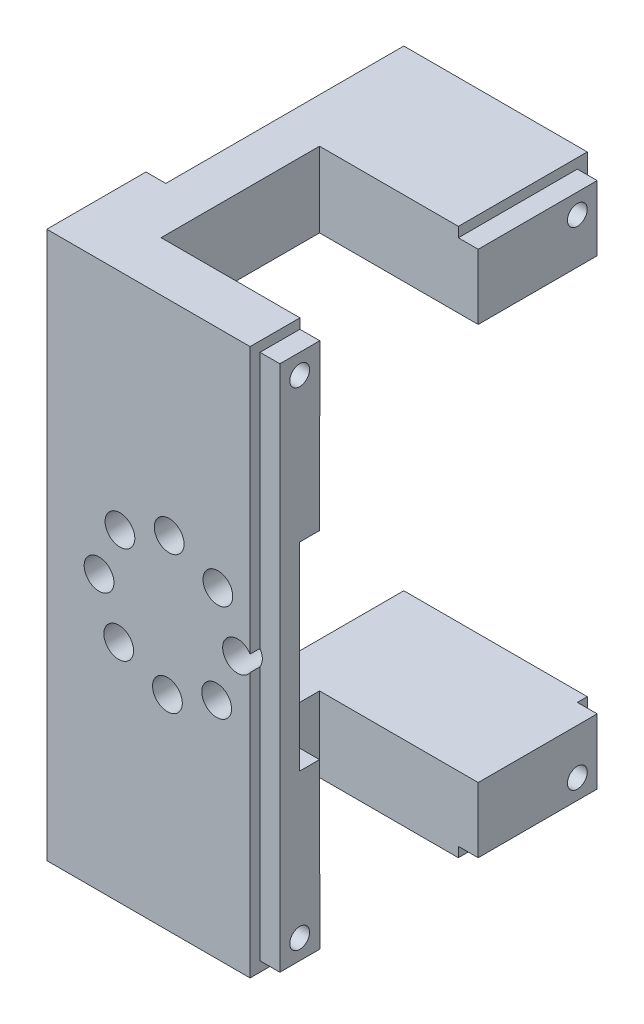
from build123d import *

# Parameters (mm, degrees)
SKETCH_1_R           = 2.000000000000001
EXTRUDE_1_DEPTH      = 29
SKETCH_2_W           = 20.5
SKETCH_2_H           = 70.28340969233892
EXTRUDE_2_DEPTH      = 3
SKETCH_3_W           = 20.5
SKETCH_3_H           = 7.570852423084727
CUT_EXTRUDE_1_DEPTH  = 49.62100286394029
SKETCH_5_R           = 2.5
EXTRUDE_3_DEPTH      = 10
CUT_EXTRUDE_2_REACH  = 75.297
SKETCH_8_R           = 1.6000000000000003
SKETCH_9_W           = 20.5
SKETCH_9_H           = 32
CUT_EXTRUDE_3_DEPTH  = 65.57298284377197
SKETCH_12_W          = 20.499999999999996
SKETCH_12_H          = 7.57085242308473
SKETCH_12_R          = 2.0000000000000018
SKETCH_12_R_2        = 2.000000000000001
EXTRUDE_5_DEPTH      = 30
EXTRUDE_6_DEPTH      = 10
SKETCH_16_R          = 1.5000000000000004
CUT_EXTRUDE_5_DEPTH  = 48.388093987806805
SKETCH_17_R          = 1.5000000000000004
CUT_EXTRUDE_6_DEPTH  = 51.404676958704755
EXTRUDE_START        = 10
SKETCH_19_R          = 4
SKETCH_19_R_2        = 2.5000000000000004
EXTRUDE_7_DEPTH      = 10
SKETCH_21_R          = 1.5000000000000004
CUT_EXTRUDE_7_DEPTH  = 48.38809406709012
SKETCH_22_R          = 1.5000000000000004
CUT_EXTRUDE_8_DEPTH  = 51.404676958704755
SKETCH_23_W          = 20.5
SKETCH_23_H          = 55.141704846169446
EXTRUDE_8_DEPTH      = 2
EXTRUDE_9_DEPTH      = 2
CUT_EXTRUDE_9_DEPTH  = 16
EXTRUDE_START_2      = 20
SKETCH_26_R          = 2.000000000000003
SKETCH_26_R_2        = 2.000000000000001
SKETCH_26_R_3        = 2.000000000000002
EXTRUDE_10_DEPTH     = 20
SKETCH_27_W          = 16
SKETCH_27_H          = 8.000000000000007
CUT_EXTRUDE_10_DEPTH = 75.49499461906014
SKETCH_29_W          = 34
SKETCH_29_H          = 55.14170484616947
CUT_EXTRUDE_11_DEPTH = 2
SKETCH_32_W          = 3.9768627953179667
SKETCH_32_H          = 6.57085242308473
CUT_EXTRUDE_13_DEPTH = 16
SKETCH_33_R          = 1.0000000000000018
CUT_EXTRUDE_14_DEPTH = 16
SKETCH_35_R          = 1.0000000000000004
CUT_EXTRUDE_15_DEPTH = 5
SKETCH_36_R          = 2.65
CUT_EXTRUDE_16_DEPTH = 10
CUT_EXTRUDE_START    = -10
SKETCH_37_R          = 2.65
CUT_EXTRUDE_17_DEPTH = 10
SKETCH_38_W          = 22.5
SKETCH_38_H          = 55.14170484616945
CUT_EXTRUDE_18_DEPTH = 50.01664477615112
SKETCH_39_R          = 1.5000000000000002
SKETCH_39_R_2        = 1.5
SKETCH_39_R_3        = 1.5000000000000004
SKETCH_39_R_4        = 1.4999999999999998
SKETCH_39_R_5        = 1.5000000000000007
SKETCH_39_R_6        = 1.4999999999999996
CUT_EXTRUDE_22_DEPTH = 5
SKETCH_41_W          = 20.499999999999993
SKETCH_41_H          = 20
CUT_EXTRUDE_23_DEPTH = 2


with BuildPart() as part:
    # 草图1 → 凸台-拉伸1 (new body)
    # profile 1 of 3: a face of its own
    with BuildSketch(Plane.XY):
        with BuildLine():
            Line((-10.250000000000004, 35.14170484616946), (-10.250000000000004, 20))
            Line((-10.25, 20.000000000000004), (-4.999999999999999, 20.000000000000004))
            Line((-4.999999999999999, 20.000000000000004), (-4.999999999999999, 23.000000000000004))
            ThreePointArc((-5.000000000000001, 23.000000000000004), (-6.414213562373094, 26.4142135623731), (-2.9999999999999982, 25.000000000000004))
            Line((-2.9999999999999982, 25.000000000000004), (3, 25.000000000000004))
            ThreePointArc((3, 25.000000000000004), (5.000000000000001, 27.000000000000004), (7.000000000000002, 25.000000000000004))
            ThreePointArc((7.000000000000002, 25.000000000000004), (6.414213562373095, 23.585786437626908), (4.999999999999999, 23.000000000000004))
            Line((5.000000000000001, 23.000000000000004), (5.000000000000001, 20.000000000000004))
            Line((5, 20.000000000000004), (10.249999999999996, 20.000000000000004))
            Line((10.249999999999996, 20), (10.249999999999996, 35.14170484616946))
            Line((10.249999999999996, 35.14170484616946), (-10.250000000000004, 35.14170484616946))
        make_face()
    # profile 2 of 3: a face of its own
    with BuildSketch(Plane.XY):
        Polygon((10.249999999999996, -20), (-10.25, -20), (-10.250000000000004, -35.14170484616946), (10.249999999999996, -35.14170484616946), align=None)
        with Locations(Location((-4.999999999999999, -25.000000000000004, 0), (0, 0, 180))):
            Circle(SKETCH_1_R, mode=Mode.SUBTRACT)
        with Locations(Location((5.000000000000001, -25.000000000000004, 0), (0, 0, 180))):
            Circle(SKETCH_1_R, mode=Mode.SUBTRACT)
    # profile 3 of 3: a face of its own
    with BuildSketch(Plane.XY):
        with BuildLine():
            Line((-4.999999999999999, 23.000000000000004), (-4.999999999999999, 20.000000000000004))
            Line((-4.999999999999999, 20.000000000000004), (5, 20.000000000000004))
            Line((5.000000000000001, 20.000000000000004), (5.000000000000001, 23.000000000000004))
            ThreePointArc((4.999999999999999, 23.000000000000004), (3.585786437626904, 23.585786437626908), (3, 25.000000000000004))
            Line((3, 25.000000000000004), (-2.9999999999999982, 25.000000000000004))
            ThreePointArc((-2.9999999999999982, 25.000000000000004), (-3.585786437626905, 23.585786437626908), (-5.000000000000001, 23.000000000000004))
        make_face()
    extrude(amount=EXTRUDE_1_DEPTH)

    # 草图2 → 凸台-拉伸2 (add)
    with BuildSketch(Plane.XY.offset(29)):
        Rectangle(SKETCH_2_W, SKETCH_2_H)
    extrude(amount=EXTRUDE_2_DEPTH)

    # 草图3 → 切除-拉伸1 (cut, through all)
    with BuildSketch(Plane(origin=(0, 0, 0), x_dir=(-1, 0, 0), z_dir=(0, 0, -1))):
        with Locations((3.55e-15, -31.356278634627095)):
            Rectangle(SKETCH_3_W, SKETCH_3_H)
        Polygon((-10.249999999999996, 35.14170484616946), (-10.249999999999996, 27.57085242308473), (10.250000000000004, 27.570852423084734), (10.250000000000004, 35.14170484616946), align=None)
    extrude(amount=-CUT_EXTRUDE_1_DEPTH, mode=Mode.SUBTRACT)

    # 草图5 → 凸台-拉伸3 (add)
    with BuildSketch(Plane.XZ.offset(27.570852423084734)):
        with Locations(Location((0, 2.5, 0), (0, 0, 270))):
            Circle(SKETCH_5_R)
    extrude(amount=EXTRUDE_3_DEPTH)

    # 草图8 → 切除-拉伸2 (cut, up to next)
    with BuildSketch(Plane(origin=(0, 27.570852423084734, 0), x_dir=(1, 0, 0), z_dir=(0, 1, 0)), mode=Mode.PRIVATE) as cut_extrude_2_sk1:
        with Locations(Location((1.71e-15, -16.5, 0), (0, 0, 270))):
            Circle(SKETCH_8_R)
    cut_extrude_2_tool1 = extrude(cut_extrude_2_sk1.sketch, amount=-CUT_EXTRUDE_2_REACH, mode=Mode.PRIVATE) & part.part
    # 草图8 → 切除-拉伸2 (cut, up to next)
    with BuildSketch(Plane(origin=(0, 27.570852423084734, 0), x_dir=(1, 0, 0), z_dir=(0, 1, 0)), mode=Mode.PRIVATE) as cut_extrude_2_sk2:
        with Locations(Location((1.22e-15, -26.500000000000004, 0), (0, 0, 270))):
            Circle(SKETCH_8_R)
    cut_extrude_2_tool2 = extrude(cut_extrude_2_sk2.sketch, amount=-CUT_EXTRUDE_2_REACH, mode=Mode.PRIVATE) & part.part
    add(cut_extrude_2_tool1.solids().sort_by_distance((0, 27.570852, 16.5))[0], mode=Mode.SUBTRACT)
    add(cut_extrude_2_tool2.solids().sort_by_distance((0, 27.570852, 26.5))[0], mode=Mode.SUBTRACT)

    # 草图9 → 切除-拉伸3 (cut, through all)
    with BuildSketch(Plane.XZ.offset(27.570852423084734)):
        with Locations((-3.55e-15, 16)):
            Rectangle(SKETCH_9_W, SKETCH_9_H)
    extrude(amount=CUT_EXTRUDE_3_DEPTH, mode=Mode.SUBTRACT)

    # 草图12 → 凸台-拉伸5 (add)
    with BuildSketch(Plane(origin=(0, 0, 0), x_dir=(-1, 0, 0), z_dir=(0, 0, -1))):
        with Locations((1.78e-15, 23.78542621154237)):
            Rectangle(SKETCH_12_W, SKETCH_12_H)
        with Locations((-5.000000000000001, 25.000000000000004)):
            Circle(SKETCH_12_R, mode=Mode.SUBTRACT)
        with Locations((4.999999999999999, 25.000000000000004)):
            Circle(SKETCH_12_R_2, mode=Mode.SUBTRACT)
    extrude(amount=-EXTRUDE_5_DEPTH)

    # 草图13 → 凸台-拉伸6 (add)
    with BuildSketch(Plane(origin=(0, 27.570852423084734, 0), x_dir=(1, 0, 0), z_dir=(0, 1, 0))):
        with BuildLine():
            ThreePointArc((4.456e-14, -7.5), (-2.5, -5.000000000000058), (-7.084e-14, -2.4999999999999996))
            Line((-1.4e-16, -2.4999999999999996), (-5e-17, -1))
            ThreePointArc((7.635e-14, -1), (-3.9999999999999996, -4.999999999999907), (-1.067e-13, -9))
            Line((-4.9e-16, -9), (-4.1e-16, -7.5))
        make_face()
        with BuildLine():
            Line((-5e-17, -1), (-1.4e-16, -2.4999999999999996))
            ThreePointArc((-7.084e-14, -2.4999999999999996), (1.7677669529663447, -3.2322330470336054), (2.500000000000001, -5))
            ThreePointArc((2.500000000000001, -5.000000000000001), (1.767766952966385, -6.767766952966354), (4.456e-14, -7.5))
            Line((-4.1e-16, -7.5), (-4.9e-16, -9))
            ThreePointArc((-1.067e-13, -9), (2.828427124746152, -7.828427124746229), (4.000000000000001, -5.000000000000001))
            ThreePointArc((4.000000000000001, -5), (2.8284271247462174, -2.171572875253837), (7.635e-14, -1))
        make_face()
    extrude(amount=EXTRUDE_6_DEPTH)

    # 草图15 → 旋转1 (revolve)
    with BuildSketch(Plane(origin=(0, 0, 0), x_dir=(0, 0, -1), z_dir=(1, 0, 0))):
        with BuildLine():
            Line((-1, 27.570852423084734), (0, 27.570852423084734))
            ThreePointArc((0, 27.570852423084734), (-0.7128919117369903, 27.930797461014013), (-1, 28.676011694509246))
            Line((-1, 28.676011694509246), (-1, 27.570852423084734))
        make_face()
    revolve(axis=Axis((0, -962.4291475769152, 4.99999999999657), (0, 1, 3.43e-15)))

    # 草图16 → 切除-拉伸5 (cut, through all)
    with BuildSketch(Plane.XY.offset(5)):
        with Locations(Location((4.9e-16, 33.57085242308473, 0), (0, 0, 90))):
            Circle(SKETCH_16_R)
    extrude(amount=-CUT_EXTRUDE_5_DEPTH, mode=Mode.SUBTRACT)

    # 草图17 → 切除-拉伸6 (cut, through all)
    with BuildSketch(Plane(origin=(0, 0, 0), x_dir=(0, 0, -1), z_dir=(1, 0, 0))):
        with Locations((-5, 33.57085242308473)):
            Circle(SKETCH_17_R)
    extrude(amount=-CUT_EXTRUDE_6_DEPTH, mode=Mode.SUBTRACT)

    # 草图19 → 凸台-拉伸7 (add)
    with BuildSketch(Plane.XZ.offset(27.570852423084734).offset(EXTRUDE_START)):
        with Locations(Location((0, 4.999999999999998, 0), (0, 0, 270))):
            Circle(SKETCH_19_R)
        with Locations(Location((0, 4.999999999999998, 0), (0, 0, 90))):
            Circle(SKETCH_19_R_2, mode=Mode.SUBTRACT)
    extrude(amount=-EXTRUDE_7_DEPTH)

    # 草图20 → 旋转2 (revolve)
    with BuildSketch(Plane(origin=(0, 0, 0), x_dir=(0, 0, -1), z_dir=(1, 0, 0))):
        with BuildLine():
            Line((-0.9999999999999983, -27.570852423084734), (0, -27.570852423084734))
            ThreePointArc((0, -27.570852423084734), (-0.7071067811865462, -27.863745641898188), (-0.9999999999999981, -28.570852423084734))
            Line((-0.9999999999999981, -28.570852423084734), (-0.9999999999999983, -27.570852423084734))
        make_face()
    revolve(axis=Axis((0, -1027.5708524230847, 4.999999999996567), (0, 1, 3.43e-15)))

    # 草图21 → 切除-拉伸7 (cut, through all)
    with BuildSketch(Plane.XY.offset(5)):
        with Locations((0, -33.57085242308473)):
            Circle(SKETCH_21_R)
    extrude(amount=-CUT_EXTRUDE_7_DEPTH, mode=Mode.SUBTRACT)

    # 草图22 → 切除-拉伸8 (cut, through all)
    with BuildSketch(Plane(origin=(0, 0, 0), x_dir=(0, 0, -1), z_dir=(1, 0, 0))):
        with Locations((-5, -33.57085242308473)):
            Circle(SKETCH_22_R)
    extrude(amount=-CUT_EXTRUDE_8_DEPTH, mode=Mode.SUBTRACT)

    # 草图23 → 凸台-拉伸8 (add)
    with BuildSketch(Plane.XY.offset(32)):
        Rectangle(SKETCH_23_W, SKETCH_23_H)
    extrude(amount=EXTRUDE_8_DEPTH)

    # 草图24 → 凸台-拉伸9 (add)
    with BuildSketch(Plane.ZY.offset(10.250000000000004)):
        Polygon((34, 27.570852423084734), (24, 27.570852423084734), (24.000000000000007, -27.570852423084713), (34, -27.57085242308472), align=None)
    extrude(amount=EXTRUDE_9_DEPTH)

    # 草图25 → 切除-拉伸9 (cut)
    with BuildSketch(Plane(origin=(10.249999999999996, 0, 0), x_dir=(0, 0, -1), z_dir=(1, 0, 0))):
        Polygon((-17, -20), (-25.000000000000004, -20), (-25.000000000000004, -27.570852423084713), (-17, -27.570852423084723), align=None)
        Polygon((-21.000000000000004, 27.570852423084734), (-25.000000000000004, 27.570852423084734), (-25.000000000000004, 20.000000000000004), (-17.000000000000004, 20.000000000000004), (-17.000000000000004, 27.570852423084734), align=None)
    extrude(amount=-CUT_EXTRUDE_9_DEPTH, mode=Mode.SUBTRACT)

    # 草图26 → 凸台-拉伸10 (add)
    with BuildSketch(Plane(origin=(0, 0, 29), x_dir=(-1, 0, 0), z_dir=(0, 0, -1)).offset(EXTRUDE_START_2)):
        with Locations((-5.000000000000001, 25.000000000000004)):
            Circle(SKETCH_26_R)
        with Locations((4.999999999999999, 25.000000000000004)):
            Circle(SKETCH_26_R_2)
        with Locations((-5.000000000000001, -25.000000000000004)):
            Circle(SKETCH_26_R_3)
        with Locations((4.999999999999999, -25.000000000000004)):
            Circle(SKETCH_26_R_2)
    extrude(amount=-EXTRUDE_10_DEPTH)

    # 草图27 → 切除-拉伸10 (cut, through all)
    with BuildSketch(Plane.XZ.offset(27.570852423084734)):
        with Locations((2.2499999999999964, 21.000000000000004)):
            Rectangle(SKETCH_27_W, SKETCH_27_H)
    extrude(amount=-CUT_EXTRUDE_10_DEPTH, mode=Mode.SUBTRACT)

    # 草图29 → 切除-拉伸11 (cut)
    with BuildSketch(Plane(origin=(10.249999999999996, 0, 0), x_dir=(0, 0, -1), z_dir=(1, 0, 0))):
        with Locations((-17, 0)):
            Rectangle(SKETCH_29_W, SKETCH_29_H)
        Polygon((-33, 26.570852423084734), (-33, -26.570852423084734), (-1, -26.570852423084734), (-1.0000000000000009, 26.570852423084734), align=None, mode=Mode.SUBTRACT)
    extrude(amount=-CUT_EXTRUDE_11_DEPTH, mode=Mode.SUBTRACT)

    # 草图32 → 切除-拉伸13 (cut)
    with BuildSketch(Plane(origin=(10.249999999999996, 0, 0), x_dir=(0, 0, -1), z_dir=(1, 0, 0))):
        Polygon((-13, 26.570852423084734), (-25.000000000000004, 26.570852423084734), (-25.000000000000004, 20.000000000000004), (-28.97686279531797, 20.000000000000004), (-28.97686279531797, -19.999999999999996), (-25.000000000000004, -20), (-25.000000000000004, -26.570852423084734), (-12.999999999999993, -26.570852423084734), align=None)
        with Locations((-26.988431397658985, 23.28542621154237)):
            Rectangle(SKETCH_32_W, SKETCH_32_H)
        Polygon((-28.97686279531797, -19.999999999999996), (-28.97686279531797, -26.570852423084734), (-25.000000000000004, -26.570852423084734), (-25.000000000000004, -20), align=None)
        Polygon((-25.000000000000004, -26.570852423084734), (-28.97686279531797, -26.570852423084734), (-28.97686279531797, -27.59191586273335), (-12.999999999999995, -27.59191586273335), (-12.999999999999995, -26.57085242308473), align=None)
        Polygon((-28.97686279531797, 27.59388998719103), (-28.97686279531797, 26.570852423084734), (-25.000000000000004, 26.570852423084734), (-13, 26.570852423084734), (-12.999999999999995, 27.59388998719103), align=None)
    extrude(amount=-CUT_EXTRUDE_13_DEPTH, mode=Mode.SUBTRACT)

    # 草图33 → 切除-拉伸14 (cut)
    with BuildSketch(Plane(origin=(10.249999999999996, 0, 0), x_dir=(0, 0, -1), z_dir=(1, 0, 0))):
        with Locations((-31, 24.57085242308473)):
            Circle(SKETCH_33_R)
        with Locations((-31, -24.57085242308473)):
            Circle(SKETCH_33_R)
    extrude(amount=-CUT_EXTRUDE_14_DEPTH, mode=Mode.SUBTRACT)

    # 草图35 → 切除-拉伸15 (cut)
    with BuildSketch(Plane(origin=(10.249999999999996, 0, 0), x_dir=(0, 0, -1), z_dir=(1, 0, 0))):
        with Locations((-3.000000000000001, 24.57085242308473)):
            Circle(SKETCH_35_R)
        with Locations((-3, -24.57085242308473)):
            Circle(SKETCH_35_R)
    extrude(amount=-CUT_EXTRUDE_15_DEPTH, mode=Mode.SUBTRACT)

    # 草图36 → 切除-拉伸16 (cut)
    with BuildSketch(Plane.XZ.offset(37.57085242308474)):
        with Locations(Location((0, 4.999999999999998, 0), (0, 0, 270))):
            Circle(SKETCH_36_R)
    extrude(amount=-CUT_EXTRUDE_16_DEPTH, mode=Mode.SUBTRACT)

    # 草图37 → 切除-拉伸17 (cut)
    with BuildSketch(Plane(origin=(0, 37.57085242308474, 0), x_dir=(1, 0, 0), z_dir=(0, 1, 0)).offset(CUT_EXTRUDE_START)):
        with Locations(Location((0, -4.999999999999965, 0), (0, 0, 90))):
            Circle(SKETCH_37_R)
    extrude(amount=CUT_EXTRUDE_17_DEPTH, mode=Mode.SUBTRACT)

    # 草图38 → 切除-拉伸18 (cut, through all)
    with BuildSketch(Plane(origin=(0, 0, 29), x_dir=(-1, 0, 0), z_dir=(0, 0, -1))):
        Polygon((-67.73698273316278, 75.48551434956308), (54.96450412174318, 75.48551434956308), (54.9645041217432, -71.43548167539623), (-67.73698273316278, -71.43548167539623), align=None)
        with Locations((1.0000000000000036, 7.11e-15)):
            Rectangle(SKETCH_38_W, SKETCH_38_H, mode=Mode.SUBTRACT)
    extrude(amount=CUT_EXTRUDE_18_DEPTH, mode=Mode.SUBTRACT)

    # 草图39 → 切除-拉伸22 (cut)
    with BuildSketch(Plane(origin=(0, 0, 29), x_dir=(-1, 0, 0), z_dir=(0, 0, -1))):
        with Locations((6.983370748804627, 0.08769706306081382)):
            Circle(SKETCH_39_R)
        with Locations((0.08769706306078953, -6.983370748804625)):
            Circle(SKETCH_39_R)
        with Locations((-6.983370748804625, -0.08769706306076437)):
            Circle(SKETCH_39_R_2)
        with Locations((-4.999999999999999, 4.8759776240390575)):
            Circle(SKETCH_39_R)
        with Locations((-0.08769706306083723, 6.983370748804625)):
            Circle(SKETCH_39_R_3)
        with Locations((4.875977624039074, 4.999999999999982)):
            Circle(SKETCH_39_R_4)
        with Locations((4.999999999999967, -4.875977624039092)):
            Circle(SKETCH_39_R_5)
        with Locations((-4.875977624039108, -4.9999999999999485)):
            Circle(SKETCH_39_R_6)
    extrude(amount=-CUT_EXTRUDE_22_DEPTH, mode=Mode.SUBTRACT)

    # 草图41 → 切除-拉伸23 (cut)
    with BuildSketch(Plane(origin=(0, 0, 29), x_dir=(-1, 0, 0), z_dir=(0, 0, -1))):
        Rectangle(SKETCH_41_W, SKETCH_41_H)
    extrude(amount=-CUT_EXTRUDE_23_DEPTH, mode=Mode.SUBTRACT)


solid = part.part
